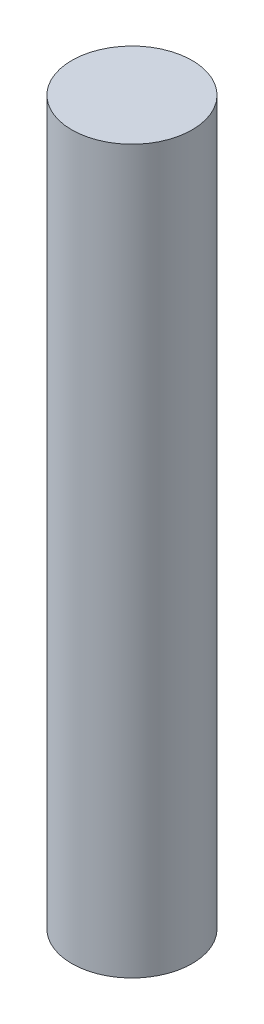
from build123d import *

# Parameters (mm, degrees)
SKETCH1_R           = 1
BOSS_EXTRUDE1_DEPTH = 12


with BuildPart() as part:
    # Sketch1 → Boss-Extrude1 (new body)
    with BuildSketch(Plane(origin=(0, 0, 0), x_dir=(1, 0, 0), z_dir=(0, 1, 0))):
        with Locations(Location((0, 0, 0), (0, 0, 270))):
            Circle(SKETCH1_R)
    extrude(amount=BOSS_EXTRUDE1_DEPTH)


solid = part.part
